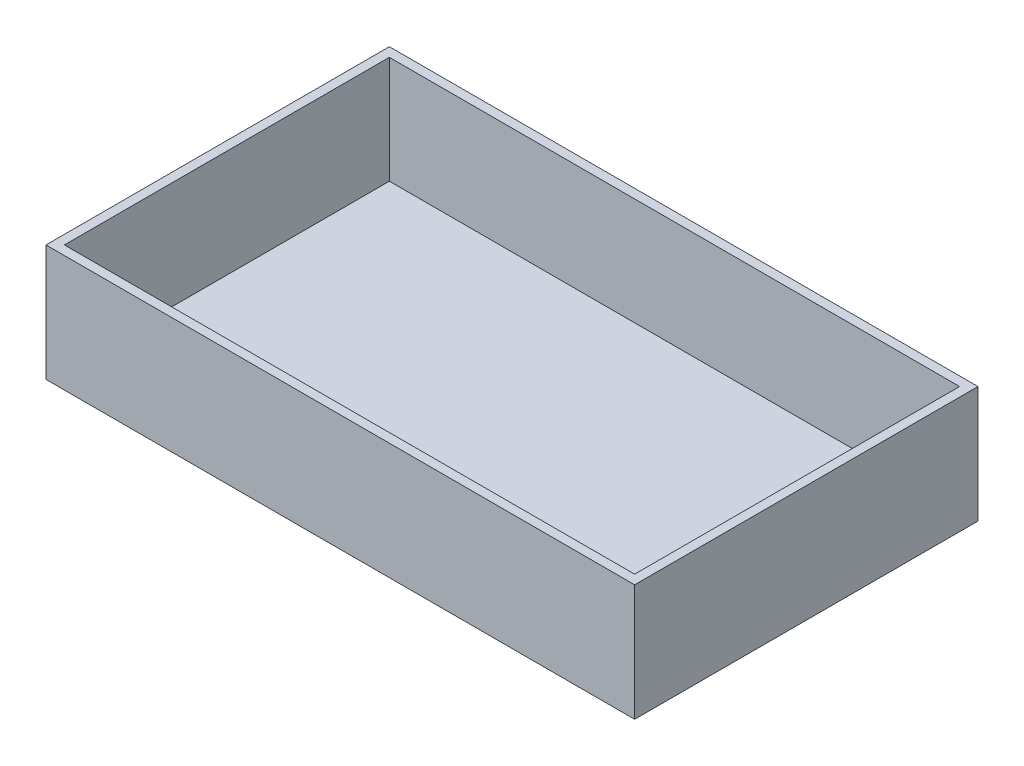
from build123d import *

# Parameters (mm, degrees)
SKETCH1_W           = 96
SKETCH1_H           = 56
BOSS_EXTRUDE1_DEPTH = 19
SHELL1_T            = -1.5
SKETCH2_W           = 35.5
SKETCH2_H           = 8
CUT_EXTRUDE2_DEPTH  = 19


with BuildPart() as part:
    # Sketch1 → Boss-Extrude1 (new body)
    with BuildSketch(Plane(origin=(0, 0, 0), x_dir=(1, 0, 0), z_dir=(0, 1, 0))):
        Rectangle(SKETCH1_W, SKETCH1_H)
    extrude(amount=BOSS_EXTRUDE1_DEPTH)

    # Shell1
    shell1_openings = [part.faces().sort_by_distance(p)[0] for p in [
        (0, 19, 0),
    ]]
    offset(amount=SHELL1_T, openings=shell1_openings, kind=Kind.INTERSECTION)

    # Sketch2 → Cut-Extrude2 (cut)
    with BuildSketch(Plane(origin=(0, 1.5, 0), x_dir=(1, 0, 0), z_dir=(0, 1, 0))):
        with Locations((-16.75, -19.5)):
            Rectangle(SKETCH2_W, SKETCH2_H)
    extrude(amount=-CUT_EXTRUDE2_DEPTH, mode=Mode.SUBTRACT)


solid = part.part
